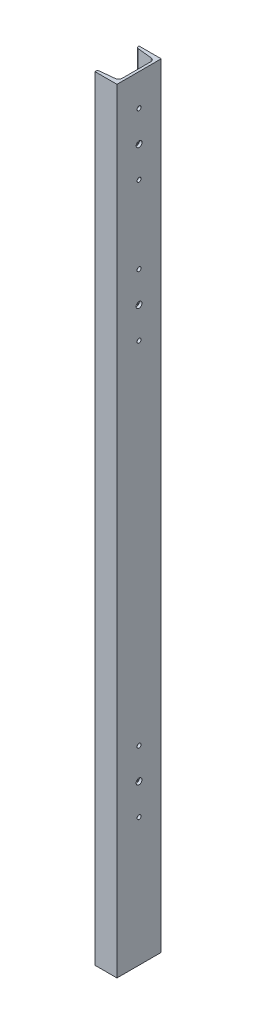
from build123d import *

# Parameters (mm, degrees)
CEOWNIK_C_100_X_10_1_DEPTH = 1750
OTW_R_13_2_13_2_1_D        = 13.2
OTW_R_13_2_13_2_1_DEPTH    = 51.034319914
OTW_R_13_2_13_2_1_TIP      = 3.965680086
OTW_R_9_2_9_2_1_D          = 9.2
OTW_R_9_2_9_2_1_DEPTH      = 52.236041152
OTW_R_9_2_9_2_1_TIP        = 2.763958848


with BuildPart() as part:
    # Sketch1 → Ceownik c 100 X 10(1) (new body)
    with BuildSketch(Plane(origin=(0, 0, 0), x_dir=(-1, 0, 0), z_dir=(0, 1, 0))):
        with BuildLine():
            Line((50, 100), (0, 100))
            Line((0, 100), (0, 0))
            Line((0, 0), (50, 0))
            Line((50, 0), (50, 1.629852671))
            ThreePointArc((50, 1.629852671), (48.844151715, 4.6409404), (45.970378085, 6.1052012))
            Line((45.970378085, 6.1052012), (13.063772294, 9.563824837))
            ThreePointArc((13.063772294, 9.563824837), (7.954841396, 12.166955149), (5.9, 17.52))
            Line((5.9, 17.52), (5.9, 82.48))
            ThreePointArc((5.9, 82.48), (7.954841396, 87.833044851), (13.063772294, 90.436175163))
            Line((13.063772294, 90.436175163), (45.970378085, 93.8947988))
            ThreePointArc((45.970378085, 93.8947988), (48.844151715, 95.3590596), (50, 98.370147329))
            Line((50, 98.370147329), (50, 100))
        make_face()
    extrude(amount=CEOWNIK_C_100_X_10_1_DEPTH)

    # Otwór Ø13.2 (13.2)1
    with Locations(Plane(origin=(0, 1608, 50), x_dir=(0, 0, 1), z_dir=(1, 0, 0))):
        with Locations((0, 0), (0, 315), (0, 1248)):
            Hole(OTW_R_13_2_13_2_1_D / 2, depth=OTW_R_13_2_13_2_1_DEPTH)
            with Locations((0, 0, -(OTW_R_13_2_13_2_1_DEPTH + OTW_R_13_2_13_2_1_TIP / 2))):  # 118° drill point
                Cone(0, OTW_R_13_2_13_2_1_D / 2, OTW_R_13_2_13_2_1_TIP, mode=Mode.SUBTRACT)

    # Otwór Ø9.2 (9.2)1
    with Locations(Plane(origin=(0, 1538, 50), x_dir=(0, 0, 1), z_dir=(1, 0, 0))):
        with Locations((0, 0), (0, -140), (0, 175), (0, 315), (0, 1108), (0, 1248)):
            Hole(OTW_R_9_2_9_2_1_D / 2, depth=OTW_R_9_2_9_2_1_DEPTH)
            with Locations((0, 0, -(OTW_R_9_2_9_2_1_DEPTH + OTW_R_9_2_9_2_1_TIP / 2))):  # 118° drill point
                Cone(0, OTW_R_9_2_9_2_1_D / 2, OTW_R_9_2_9_2_1_TIP, mode=Mode.SUBTRACT)


solid = part.part
